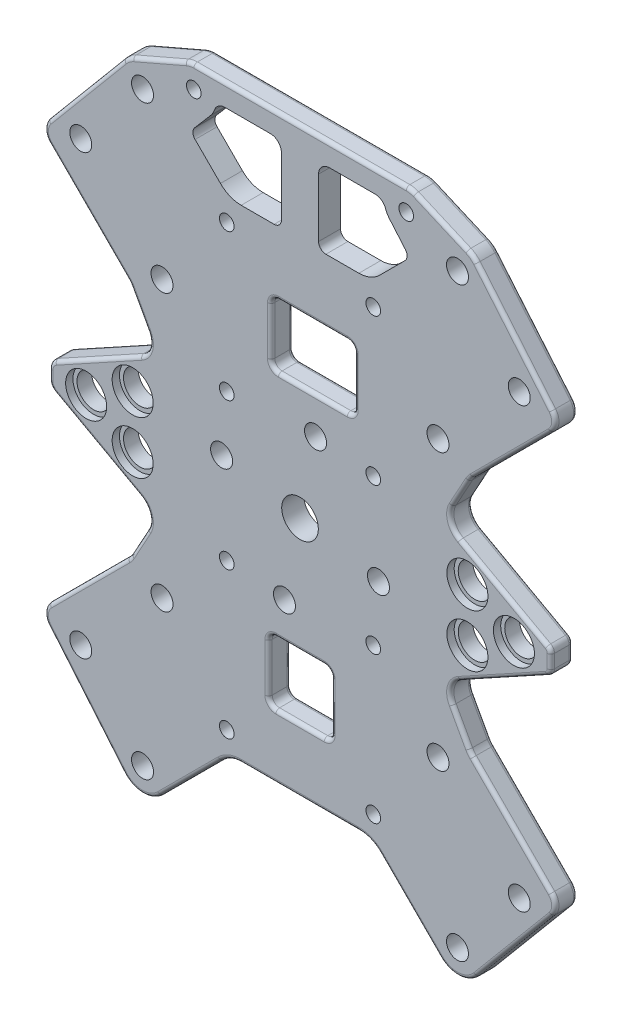
from build123d import *

# Parameters (mm, degrees)
SKETCH_1_R          = 1.5
SKETCH_1_R_2        = 1
SKETCH_1_R_3        = 2.5
EXTRUDE_1_DEPTH     = 3
SKETCH_3_R          = 2.25
EXTRUDE_2_DEPTH     = 3
SKETCH_4_R          = 2.8
CUT_EXTRUDE_1_DEPTH = 1
EXTRUDE_START       = -3
SKETCH_5_R          = 1
EXTRUDE_3_DEPTH     = 3
FILLET_2_R          = 1
FILLET_1_R          = 0.5


with BuildPart() as part:
    # 草图1 → 凸台-拉伸1 (new body)
    with BuildSketch(Plane.XY):
        with BuildLine():
            Line((-19.095836944, 42.404163056), (-10.863246763, 34.171572875))
            ThreePointArc((-10.863246763, 34.171572875), (-9.565553368, 33.30448187), (-8.034819638, 33))
            Line((-8.034819638, 33), (8.034819638, 33))
            ThreePointArc((8.034819638, 33), (9.565553368, 33.30448187), (10.863246763, 34.171572875))
            Line((10.863246763, 34.171572875), (19.095836944, 42.404163056))
            ThreePointArc((19.095836944, 42.404163056), (21.649591792, 43.396707567), (24.106205037, 42.183505279))
            Line((24.106205037, 42.183505279), (34.394641591, 29.903353987))
            ThreePointArc((34.394641591, 29.903353987), (34.859643079, 28.530943945), (34.275793367, 27.204725555))
            Line((34.275793367, 27.204725555), (23.574450067, 16.503382255))
            ThreePointArc((23.574450067, 16.503382255), (23.296330718, 16.182808746), (23.066231555, 15.826196741))
            Line((23.066231555, 15.826196741), (19.620461144, 9.551999205))
            ThreePointArc((19.620461144, 9.551999205), (19.344090799, 8.853311702), (19.25, 8.107864376))
            Line((19.25, 8.107864376), (19.25, -8.107864376))
            ThreePointArc((19.25, -8.107864376), (19.344090799, -8.853311702), (19.620461144, -9.551999205))
            Line((19.620461144, -9.551999205), (23.066231555, -15.826196741))
            ThreePointArc((23.066231555, -15.826196741), (23.296330718, -16.182808746), (23.574450067, -16.503382255))
            Line((23.574450067, -16.503382255), (34.275793367, -27.204725555))
            ThreePointArc((34.275793367, -27.204725555), (34.859643079, -28.530943945), (34.394641591, -29.903353987))
            Line((34.394641591, -29.903353987), (24.106205037, -42.183505279))
            ThreePointArc((24.106205037, -42.183505279), (21.649591792, -43.396707567), (19.095836944, -42.404163056))
            Line((19.095836944, -42.404163056), (10.863246763, -34.171572875))
            ThreePointArc((10.863246763, -34.171572875), (9.565553368, -33.30448187), (8.034819638, -33))
            Line((8.034819638, -33), (-8.034819638, -33))
            ThreePointArc((-8.034819638, -33), (-9.565553368, -33.30448187), (-10.863246763, -34.171572875))
            Line((-10.863246763, -34.171572875), (-19.095836944, -42.404163056))
            ThreePointArc((-19.095836944, -42.404163056), (-21.649591792, -43.396707567), (-24.106205037, -42.183505279))
            Line((-24.106205037, -42.183505279), (-34.394641591, -29.903353987))
            ThreePointArc((-34.394641591, -29.903353987), (-34.859643079, -28.530943945), (-34.275793367, -27.204725555))
            Line((-34.275793367, -27.204725555), (-23.574450067, -16.503382255))
            ThreePointArc((-23.574450067, -16.503382255), (-23.296330718, -16.182808746), (-23.066231555, -15.826196741))
            Line((-23.066231555, -15.826196741), (-19.620461144, -9.551999205))
            ThreePointArc((-19.620461144, -9.551999205), (-19.344090799, -8.853311702), (-19.25, -8.107864376))
            Line((-19.25, -8.107864376), (-19.25, 8.107864376))
            ThreePointArc((-19.25, 8.107864376), (-19.344090799, 8.853311702), (-19.620461144, 9.551999205))
            Line((-19.620461144, 9.551999205), (-23.066231555, 15.826196741))
            ThreePointArc((-23.066231555, 15.826196741), (-23.296330718, 16.182808746), (-23.574450067, 16.503382255))
            Line((-23.574450067, 16.503382255), (-34.275793367, 27.204725555))
            ThreePointArc((-34.275793367, 27.204725555), (-34.859643079, 28.530943945), (-34.394641591, 29.903353987))
            Line((-34.394641591, 29.903353987), (-24.106205037, 42.183505279))
            ThreePointArc((-24.106205037, 42.183505279), (-21.649591792, 43.396707567), (-19.095836944, 42.404163056))
        make_face()
        with Locations((21.5, -40)):
            Circle(SKETCH_1_R, mode=Mode.SUBTRACT)
        with Locations((21.5, 40)):
            Circle(SKETCH_1_R, mode=Mode.SUBTRACT)
        with Locations((-21.5, 40)):
            Circle(SKETCH_1_R, mode=Mode.SUBTRACT)
        with Locations((-21.5, -40)):
            Circle(SKETCH_1_R, mode=Mode.SUBTRACT)
        with Locations((-2.121320344, -10.707106781)):
            Circle(SKETCH_1_R, mode=Mode.SUBTRACT)
        with Locations((10.707106781, -2.121320344)):
            Circle(SKETCH_1_R, mode=Mode.SUBTRACT)
        with Locations((2.121320344, 10.707106781)):
            Circle(SKETCH_1_R, mode=Mode.SUBTRACT)
        with Locations((-10.707106781, 2.121320344)):
            Circle(SKETCH_1_R, mode=Mode.SUBTRACT)
        with Locations((-18.838834765, -18.838834765)):
            Circle(SKETCH_1_R, mode=Mode.SUBTRACT)
        with Locations((-29.933672392, -29.933672392)):
            Circle(SKETCH_1_R, mode=Mode.SUBTRACT)
        with Locations((18.838834765, -18.838834765)):
            Circle(SKETCH_1_R, mode=Mode.SUBTRACT)
        with Locations((29.933672392, -29.933672392)):
            Circle(SKETCH_1_R, mode=Mode.SUBTRACT)
        with Locations((29.933672392, 29.933672392)):
            Circle(SKETCH_1_R, mode=Mode.SUBTRACT)
        with Locations((18.838834765, 18.838834765)):
            Circle(SKETCH_1_R, mode=Mode.SUBTRACT)
        with Locations((-29.933672392, 29.933672392)):
            Circle(SKETCH_1_R, mode=Mode.SUBTRACT)
        with Locations((-18.838834765, 18.838834765)):
            Circle(SKETCH_1_R, mode=Mode.SUBTRACT)
        with Locations((-10, -30)):
            Circle(SKETCH_1_R_2, mode=Mode.SUBTRACT)
        with Locations((10, -30)):
            Circle(SKETCH_1_R_2, mode=Mode.SUBTRACT)
        with Locations((10, 30)):
            Circle(SKETCH_1_R_2, mode=Mode.SUBTRACT)
        with Locations((-10, 30)):
            Circle(SKETCH_1_R_2, mode=Mode.SUBTRACT)
        Circle(SKETCH_1_R_3, mode=Mode.SUBTRACT)
        with Locations((-10, 10)):
            Circle(SKETCH_1_R_2, mode=Mode.SUBTRACT)
        with Locations((10, 10)):
            Circle(SKETCH_1_R_2, mode=Mode.SUBTRACT)
        with Locations((10, -10)):
            Circle(SKETCH_1_R_2, mode=Mode.SUBTRACT)
        with Locations((-10, -10)):
            Circle(SKETCH_1_R_2, mode=Mode.SUBTRACT)
        with BuildLine():
            Line((7.446339079, 16.707106781), (7.446339079, 23.292893219))
            ThreePointArc((7.446339079, 23.292893219), (7.15344586, 24), (6.446339079, 24.292893219))
            Line((6.446339079, 24.292893219), (-2.946339079, 24.292893219))
            ThreePointArc((-2.946339079, 24.292893219), (-3.65344586, 24), (-3.946339079, 23.292893219))
            Line((-3.946339079, 23.292893219), (-3.946339079, 16.707106781))
            ThreePointArc((-3.946339079, 16.707106781), (-3.65344586, 16), (-2.946339079, 15.707106781))
            Line((-2.946339079, 15.707106781), (6.446339079, 15.707106781))
            ThreePointArc((6.446339079, 15.707106781), (7.15344586, 16), (7.446339079, 16.707106781))
        make_face(mode=Mode.SUBTRACT)
        with BuildLine():
            Line((4.292893219, -23.292893219), (4.292893219, -16.707106781))
            ThreePointArc((4.292893219, -16.707106781), (4, -16), (3.292893219, -15.707106781))
            Line((3.292893219, -15.707106781), (-3.292893219, -15.707106781))
            ThreePointArc((-3.292893219, -15.707106781), (-4, -16), (-4.292893219, -16.707106781))
            Line((-4.292893219, -16.707106781), (-4.292893219, -23.292893219))
            ThreePointArc((-4.292893219, -23.292893219), (-4, -24), (-3.292893219, -24.292893219))
            Line((-3.292893219, -24.292893219), (3.292893219, -24.292893219))
            ThreePointArc((3.292893219, -24.292893219), (4, -24), (4.292893219, -23.292893219))
        make_face(mode=Mode.SUBTRACT)
    extrude(amount=EXTRUDE_1_DEPTH)

    # 草图3 → 凸台-拉伸2 (add)
    # profile 1 of 2: a face of its own
    with BuildSketch(Plane.XY):
        with BuildLine():
            Line((-21.808626212, 8.347647956), (-33.47327483, 1.927504279))
            ThreePointArc((-33.47327483, 1.927504279), (-34.041300167, 1.376644302), (-34.25, 0.613398681))
            Line((-34.25, 0.613398681), (-34.25, -0.613398681))
            ThreePointArc((-34.25, -0.613398681), (-34.041300167, -1.376644302), (-33.47327483, -1.927504279))
            Line((-33.47327483, -1.927504279), (-21.808626212, -8.347647956))
            ThreePointArc((-21.808626212, -8.347647956), (-20.613328459, -9.840420499), (-20.822801882, -11.741269642))
            Line((-20.822801882, -11.741269642), (-23.066231555, -15.826196741))
            ThreePointArc((-23.066231555, -15.826196741), (-14.957904998, -10.495137357), (-17.768601976, -1.207234677))
            ThreePointArc((-17.768601976, -1.207234677), (-18.378329864, 0), (-17.768601976, 1.207234677))
            ThreePointArc((-17.768601976, 1.207234677), (-14.957904998, 10.495137357), (-23.066231555, 15.826196741))
            Line((-23.066231555, 15.826196741), (-20.822801882, 11.741269642))
            ThreePointArc((-20.822801882, 11.741269642), (-20.613328459, 9.840420499), (-21.808626212, 8.347647956))
        make_face()
        with Locations((-29.200590524, 0)):
            Circle(SKETCH_3_R, mode=Mode.SUBTRACT)
        with Locations((-22.85, 3.6)):
            Circle(SKETCH_3_R, mode=Mode.SUBTRACT)
        with Locations(Location((-22.85, -3.6, 0), (0, 0, 180))):
            Circle(SKETCH_3_R, mode=Mode.SUBTRACT)
    # profile 2 of 2: a face of its own
    with BuildSketch(Plane.XY):
        with BuildLine():
            Line((21.808626212, -8.347647956), (33.73218322, -1.785002852))
            ThreePointArc((33.73218322, -1.785002852), (34.110866778, -1.417762868), (34.25, -0.908932454))
            Line((34.25, -0.908932454), (34.25, 0.908932454))
            ThreePointArc((34.25, 0.908932454), (34.110866778, 1.417762868), (33.73218322, 1.785002852))
            Line((33.73218322, 1.785002852), (21.808626212, 8.347647956))
            ThreePointArc((21.808626212, 8.347647956), (20.613328459, 9.840420499), (20.822801882, 11.741269642))
            Line((20.822801882, 11.741269642), (23.066231555, 15.826196741))
            ThreePointArc((23.066231555, 15.826196741), (14.85510594, 10.193027474), (18.296679703, 0.849005328))
            ThreePointArc((18.296679703, 0.849005328), (18.768295417, 0), (18.296679703, -0.849005328))
            ThreePointArc((18.296679703, -0.849005328), (14.85510594, -10.193027474), (23.066231555, -15.826196741))
            Line((23.066231555, -15.826196741), (20.822801882, -11.741269642))
            ThreePointArc((20.822801882, -11.741269642), (20.613328459, -9.840420499), (21.808626212, -8.347647956))
        make_face()
        with Locations(Location((22.85, 3.6, 0), (0, 0, 180))):
            Circle(SKETCH_3_R, mode=Mode.SUBTRACT)
        with Locations((22.85, -3.6)):
            Circle(SKETCH_3_R, mode=Mode.SUBTRACT)
        with Locations(Location((29.200590524, 0, 0), (0, 0, 180))):
            Circle(SKETCH_3_R, mode=Mode.SUBTRACT)
    extrude(amount=EXTRUDE_2_DEPTH)

    # 草图4 → 切除-拉伸1 (cut)
    with BuildSketch(Plane.XY.offset(3)):
        with Locations((-22.85, 3.6)):
            Circle(SKETCH_4_R)
        with Locations((-29.200590524, 0)):
            Circle(SKETCH_4_R)
        with Locations((-22.85, -3.6)):
            Circle(SKETCH_4_R)
        with Locations((22.85, 3.6)):
            Circle(SKETCH_4_R)
        with Locations((29.200590524, 0)):
            Circle(SKETCH_4_R)
        with Locations((22.85, -3.6)):
            Circle(SKETCH_4_R)
    extrude(amount=-CUT_EXTRUDE_1_DEPTH, mode=Mode.SUBTRACT)

    # 草图5 → 凸台-拉伸3 (add)
    with BuildSketch(Plane.XY.offset(3).offset(EXTRUDE_START)):
        with BuildLine():
            Line((22.85036286, 43.120339749), (15.691496641, 46.218421316))
            ThreePointArc((15.691496641, 46.218421316), (15.108390145, 46.402842941), (14.5, 46.465180362))
            Line((14.5, 46.465180362), (-14.5, 46.465180362))
            ThreePointArc((-14.5, 46.465180362), (-15.108390145, 46.402842941), (-15.691496641, 46.218421316))
            Line((-15.691496641, 46.218421316), (-22.85036286, 43.120339749))
            ThreePointArc((-22.85036286, 43.120339749), (-20.862935657, 43.339782781), (-19.095836944, 42.404163056))
            Line((-19.095836944, 42.404163056), (-13.757464902, 33.704103492))
            Line((-13.757464902, 33.704103492), (0.241012461, 29.906066998))
            Line((0.241012461, 29.906066998), (12.611759898, 33))
            Line((12.611759898, 33), (19.095836944, 42.404163056))
            ThreePointArc((19.095836944, 42.404163056), (20.862935657, 43.339782781), (22.85036286, 43.120339749))
        make_face()
        with Locations((-14.5, 43.465180362)):
            Circle(SKETCH_5_R, mode=Mode.SUBTRACT)
        with Locations((14.5, 43.465180362)):
            Circle(SKETCH_5_R, mode=Mode.SUBTRACT)
        with BuildLine():
            Line((2.534819638, 41.965180362), (2.534819638, 33))
            Line((2.534819638, 33), (8.034819638, 33))
            ThreePointArc((8.034819638, 33), (9.565553368, 33.30448187), (10.863246763, 34.171572875))
            Line((10.863246763, 34.171572875), (14.979541854, 38.287867966))
            Line((14.979541854, 38.287867966), (12.21981499, 41.51562751))
            ThreePointArc((12.21981499, 41.51562751), (11.901944547, 41.965144408), (11.671572875, 42.465180362))
            ThreePointArc((11.671572875, 42.465180362), (11.123384717, 43.189925233), (10.257359313, 43.465180362))
            Line((10.257359313, 43.465180362), (4.034819638, 43.465180362))
            ThreePointArc((4.034819638, 43.465180362), (2.974159467, 43.025840533), (2.534819638, 41.965180362))
        make_face(mode=Mode.SUBTRACT)
        with BuildLine():
            Line((-2.534819638, 41.965180362), (-2.534819638, 33))
            Line((-2.534819638, 33), (-8.034819638, 33))
            ThreePointArc((-8.034819638, 33), (-9.565553368, 33.30448187), (-10.863246763, 34.171572875))
            Line((-10.863246763, 34.171572875), (-14.979541854, 38.287867966))
            Line((-14.979541854, 38.287867966), (-12.21981499, 41.51562751))
            ThreePointArc((-12.21981499, 41.51562751), (-11.901944547, 41.965144408), (-11.671572875, 42.465180362))
            ThreePointArc((-11.671572875, 42.465180362), (-11.123384717, 43.189925233), (-10.257359313, 43.465180362))
            Line((-10.257359313, 43.465180362), (-4.034819638, 43.465180362))
            ThreePointArc((-4.034819638, 43.465180362), (-2.974159467, 43.025840533), (-2.534819638, 41.965180362))
        make_face(mode=Mode.SUBTRACT)
    extrude(amount=EXTRUDE_3_DEPTH)

    # 圆角2
    fillet_2_edges = [part.edges().sort_by_distance(p)[0] for p in [
        (14.979541854, 38.287867966, 1.5),
        (2.534819638, 33, 1.5),
        (-2.534819638, 33, 1.5),
        (-14.979541854, 38.287867966, 1.5),
    ]]
    fillet(fillet_2_edges, radius=FILLET_2_R)

    # 圆角1
    fillet_1_edges = [part.edges().sort_by_distance(p)[0] for p in [
        (23.296330718, -16.182808746, 3),
        (21.944516718, -13.783733192, 3),
        (23.296330718, 16.182808746, 3),
        (28.925121717, 21.854053905, 3),
        (-34.859643079, 28.530943945, 3),
        (34.859643079, 28.530943945, 3),
        (29.250423314, 36.043429633, 3),
        (23.532983543, 42.72524823, 3),
        (-28.925121717, 21.854053905, 3),
        (7.15344586, 16, 0),
        (7.446339079, 20, 0),
        (7.15344586, 24, 0),
        (1.75, 24.292893219, 0),
        (-3.65344586, 24, 0),
        (-3.946339079, 20, 0),
        (-3.65344586, 16, 0),
        (1.75, 15.707106781, 0),
        (7.15344586, 16, 3),
        (7.446339079, 20, 3),
        (7.15344586, 24, 3),
        (1.75, 24.292893219, 3),
        (-3.65344586, 24, 3),
        (-3.946339079, 20, 3),
        (-3.65344586, 16, 3),
        (1.75, 15.707106781, 3),
        (-23.296330718, 16.182808746, 3),
        (4, -24, 0),
        (4.292893219, -20, 0),
        (4, -16, 0),
        (0, -15.707106781, 0),
        (-4, -16, 0),
        (-4.292893219, -20, 0),
        (-4, -24, 0),
        (0, -24.292893219, 0),
        (4, -24, 3),
        (4.292893219, -20, 3),
        (4, -16, 3),
        (0, -15.707106781, 3),
        (-4, -16, 3),
        (-4.292893219, -20, 3),
        (-4, -24, 3),
        (0, -24.292893219, 3),
        (-21.944516718, 13.783733192, 3),
        (-21.944516718, -13.783733192, 0),
        (-21.944516718, -13.783733192, 3),
        (-20.613328459, 9.840420499, 3),
        (-27.640950521, 5.137576117, 3),
        (-34.041300167, 1.376644302, 3),
        (-34.25, 0, 3),
        (-34.041300167, -1.376644302, 3),
        (-27.640950521, -5.137576117, 3),
        (-20.613328459, -9.840420499, 3),
        (-20.613328459, -9.840420499, 0),
        (-27.640950521, -5.137576117, 0),
        (-34.041300167, -1.376644302, 0),
        (-34.25, 0, 0),
        (-34.041300167, 1.376644302, 0),
        (-27.640950521, 5.137576117, 0),
        (-20.613328459, 9.840420499, 0),
        (21.944516718, 13.783733192, 0),
        (21.944516718, 13.783733192, 3),
        (20.613328459, -9.840420499, 3),
        (27.770404716, -5.066325404, 3),
        (34.110866778, -1.417762868, 3),
        (34.25, 0, 3),
        (34.110866778, 1.417762868, 3),
        (27.770404716, 5.066325404, 3),
        (20.613328459, 9.840420499, 3),
        (20.613328459, 9.840420499, 0),
        (27.770404716, 5.066325404, 0),
        (34.110866778, 1.417762868, 0),
        (34.25, 0, 0),
        (34.110866778, -1.417762868, 0),
        (27.770404716, -5.066325404, 0),
        (20.613328459, -9.840420499, 0),
        (-23.532983543, 42.72524823, 0),
        (-23.532983543, 42.72524823, 3),
        (19.27092975, 44.669380532, 3),
        (15.108390145, 46.402842941, 3),
        (0, 46.465180362, 3),
        (-15.108390145, 46.402842941, 3),
        (-19.27092975, 44.669380532, 3),
        (-19.27092975, 44.669380532, 0),
        (-15.108390145, 46.402842941, 0),
        (0, 46.465180362, 0),
        (15.108390145, 46.402842941, 0),
        (19.27092975, 44.669380532, 0),
        (23.532983543, 42.72524823, 0),
        (29.250423314, 36.043429633, 0),
        (34.859643079, 28.530943945, 0),
        (28.925121717, 21.854053905, 0),
        (23.296330718, 16.182808746, 0),
        (21.944516718, -13.783733192, 0),
        (23.296330718, -16.182808746, 0),
        (28.925121717, -21.854053905, 0),
        (34.859643079, -28.530943945, 0),
        (29.250423314, -36.043429633, 0),
        (-23.296330718, -16.182808746, 3),
        (21.649591792, -43.396707567, 0),
        (14.979541854, -38.287867966, 0),
        (9.565553368, -33.30448187, 0),
        (0, -33, 0),
        (-9.565553368, -33.30448187, 0),
        (-14.979541854, -38.287867966, 0),
        (-21.649591792, -43.396707567, 0),
        (-29.250423314, -36.043429633, 0),
        (-34.859643079, -28.530943945, 0),
        (-28.925121717, -21.854053905, 0),
        (-28.925121717, -21.854053905, 3),
        (-23.296330718, -16.182808746, 0),
        (-21.944516718, 13.783733192, 0),
        (-23.296330718, 16.182808746, 0),
        (-28.925121717, 21.854053905, 0),
        (-34.859643079, 28.530943945, 0),
        (-29.250423314, 36.043429633, 0),
        (-34.859643079, -28.530943945, 3),
        (-29.250423314, -36.043429633, 3),
        (-21.649591792, -43.396707567, 3),
        (-14.979541854, -38.287867966, 3),
        (-9.565553368, -33.30448187, 3),
        (0, -33, 3),
        (9.565553368, -33.30448187, 3),
        (14.979541854, -38.287867966, 3),
        (21.649591792, -43.396707567, 3),
        (29.250423314, -36.043429633, 3),
        (-29.250423314, 36.043429633, 3),
        (34.859643079, -28.530943945, 3),
        (28.925121717, -21.854053905, 3),
    ]]
    fillet(fillet_1_edges, radius=FILLET_1_R)


solid = part.part
